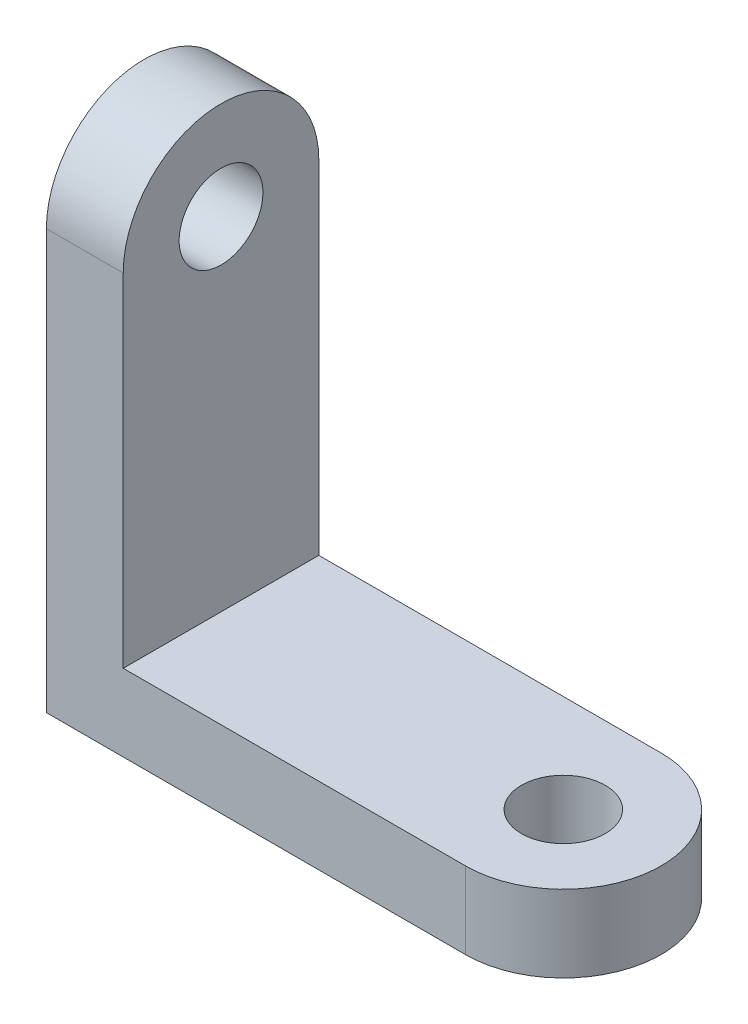
from build123d import *

# Parameters (mm, degrees)
BOSS_EXTRUDE1_DEPTH = 2.75
SKETCH3_R           = 1.5
CUT_EXTRUDE1_DEPTH  = 2.75
BOSS_EXTRUDE2_DEPTH = 2.75
SKETCH6_R           = 1.5
CUT_EXTRUDE2_DEPTH  = 2.75


with BuildPart() as part:
    # Sketch1 → Boss-Extrude1 (new body)
    with BuildSketch(Plane(origin=(0, 0, 0), x_dir=(1, 0, 0), z_dir=(0, 1, 0))):
        with BuildLine():
            Line((-7.5, 3.5), (7.5, 3.5))
            ThreePointArc((7.5, 3.5), (11, 0), (7.5, -3.5))
            Line((7.5, -3.5), (-7.5, -3.5))
            Line((-7.5, -3.5), (-7.5, 3.5))
        make_face()
    extrude(amount=BOSS_EXTRUDE1_DEPTH)

    # Sketch3 → Cut-Extrude1 (cut)
    with BuildSketch(Plane(origin=(0, 2.75, 0), x_dir=(1, 0, 0), z_dir=(0, 1, 0))):
        with Locations(Location((7.5, 0, 0), (0, 0, 270))):
            Circle(SKETCH3_R)
    extrude(amount=-CUT_EXTRUDE1_DEPTH, mode=Mode.SUBTRACT)

    # Sketch5 → Boss-Extrude2 (add)
    with BuildSketch(Plane.ZY.offset(7.5)):
        with BuildLine():
            Line((-3.5, 0), (3.5, 0))
            Line((3.5, 0), (3.5, 15))
            ThreePointArc((3.5, 15), (0, 18.5), (-3.5, 15))
            Line((-3.5, 15), (-3.5, 0))
        make_face()
    extrude(amount=-BOSS_EXTRUDE2_DEPTH)

    # Sketch6 → Cut-Extrude2 (cut)
    with BuildSketch(Plane(origin=(-4.75, 0, 0), x_dir=(0, 0, -1), z_dir=(1, 0, 0))):
        with Locations((0, 15)):
            Circle(SKETCH6_R)
    extrude(amount=-CUT_EXTRUDE2_DEPTH, mode=Mode.SUBTRACT)


solid = part.part
